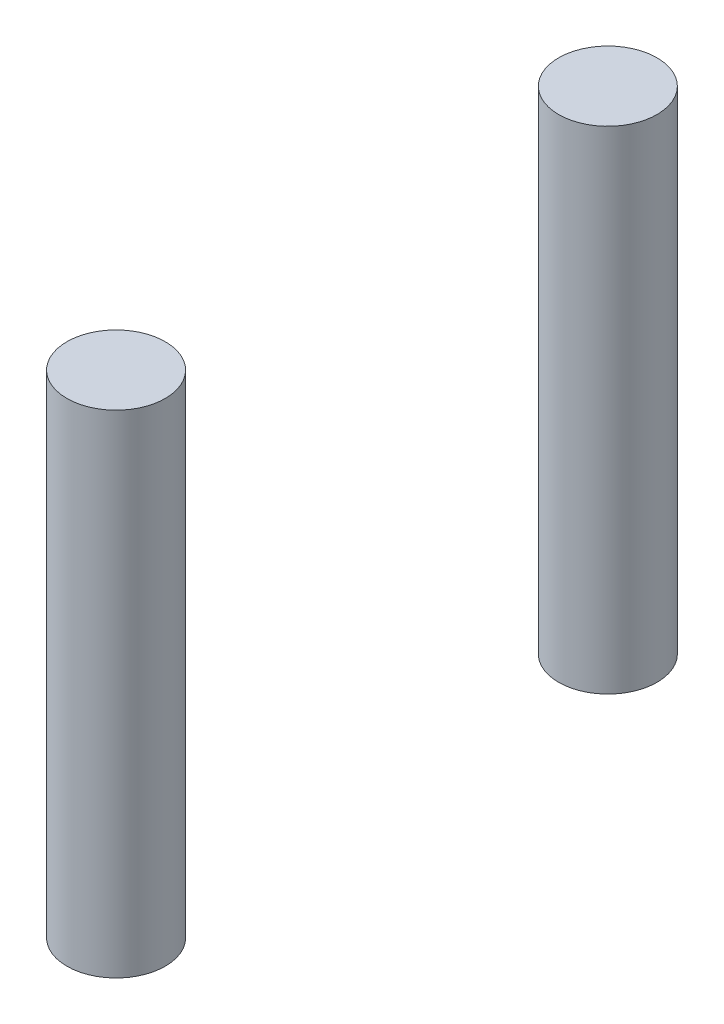
from build123d import *

# Parameters (mm, degrees)
EXTRUDE_START     = -3
SKETCH_1_R        = 1
EXTRUDE_3_DEPTH   = 10
EXTRUDE_3_2_DEPTH = 10


with BuildPart() as part:
    # Эскиз1 → Бобышка-Вытянуть3 (new body)
    with BuildSketch(Plane(origin=(0, 0, 0), x_dir=(1, 0, 0), z_dir=(0, 1, 0)).offset(EXTRUDE_START)):
        with Locations(Location((0, -5, 0), (0, 0, 270))):
            Circle(SKETCH_1_R)
    extrude(amount=-EXTRUDE_3_DEPTH)


with BuildPart() as body_2:
    # Эскиз1 → Extrude 3 2 (new body)
    with BuildSketch(Plane(origin=(0, 0, 0), x_dir=(1, 0, 0), z_dir=(0, 1, 0)).offset(EXTRUDE_START)):
        with Locations(Location((0, 5, 0), (0, 0, 270))):
            Circle(SKETCH_1_R)
    extrude(amount=-EXTRUDE_3_2_DEPTH)


solid = Compound([part.part, body_2.part])
